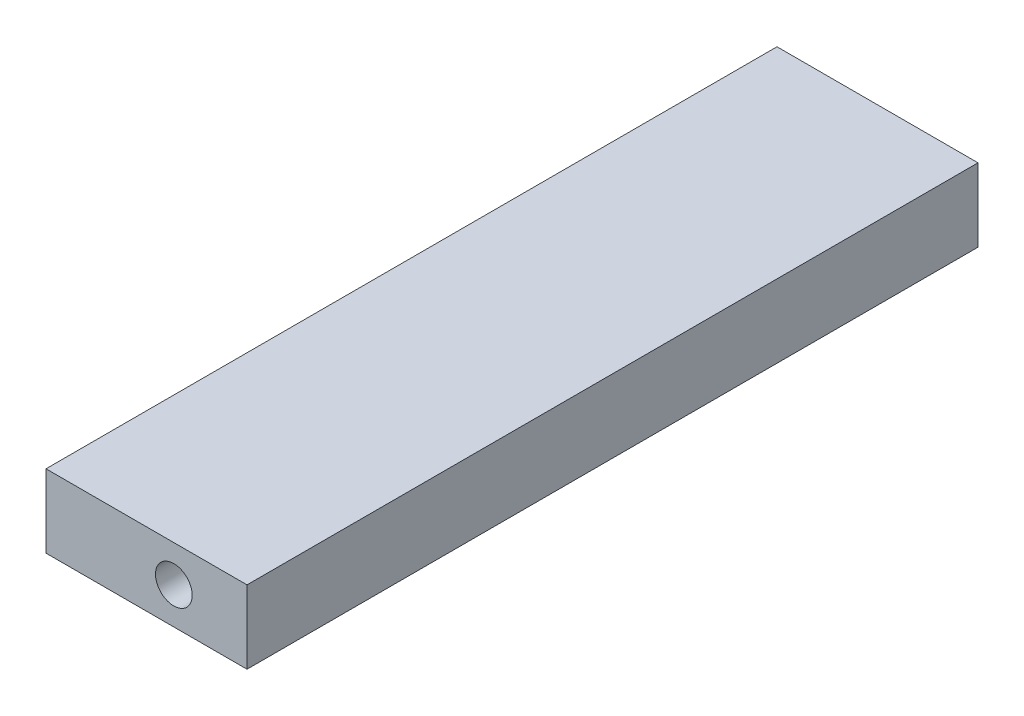
from build123d import *

# Parameters (mm, degrees)
SKETCH1_W               = 27.94
SKETCH1_H               = 10.16
BOSS_EXTRUDE1_DEPTH     = 101.6
SKETCH3_R               = 2.5527
CUT_EXTRUDE2_DEPTH      = 96.148345755
CUT_EXTRUDE3_REACH      = 107.494
CUT_EXTRUDE3_END_RADIUS = 2.5527
SKETCH4_R               = 2.5527


with BuildPart() as part:
    # Sketch1 → Boss-Extrude1 (new body)
    with BuildSketch(Plane.XY):
        Rectangle(SKETCH1_W, SKETCH1_H)
    extrude(amount=BOSS_EXTRUDE1_DEPTH)

    # Sketch3 → Cut-Extrude2 (cut, through all)
    with BuildSketch(Plane(origin=(0, 0, 7.62), x_dir=(-1, 0, 0), z_dir=(0, 0, -1))):
        with Locations((-3.7973, 0)):
            Circle(SKETCH3_R)
    extrude(amount=-CUT_EXTRUDE2_DEPTH, mode=Mode.SUBTRACT)

    # Cut-Extrude3: up to this cylinder (the profile starts outside it)
    cut_extrude3_end = Plane(origin=(3.7973, 0, 49.5554), z_dir=(0, 0, -1)) * Cylinder(CUT_EXTRUDE3_END_RADIUS, 287.1334, mode=Mode.PRIVATE)
    # Sketch4 → Cut-Extrude3 (cut, up to the surface)
    with BuildSketch(Plane.ZY.offset(13.97), mode=Mode.PRIVATE) as cut_extrude3_sk1:
        with Locations((16.5354, 0)):
            Circle(SKETCH4_R)
    cut_extrude3_tool1 = extrude(cut_extrude3_sk1.sketch, amount=-CUT_EXTRUDE3_REACH, mode=Mode.PRIVATE) - cut_extrude3_end
    add(cut_extrude3_tool1.solids().sort_by_distance((-13.97, 0, 16.5354))[0], mode=Mode.SUBTRACT)
    # Sketch4 → Cut-Extrude3 (cut, up to the surface)
    with BuildSketch(Plane.ZY.offset(13.97), mode=Mode.PRIVATE) as cut_extrude3_sk2:
        with Locations((33.0454, 0)):
            Circle(SKETCH4_R)
    cut_extrude3_tool2 = extrude(cut_extrude3_sk2.sketch, amount=-CUT_EXTRUDE3_REACH, mode=Mode.PRIVATE) - cut_extrude3_end
    add(cut_extrude3_tool2.solids().sort_by_distance((-13.97, 0, 33.0454))[0], mode=Mode.SUBTRACT)
    # Sketch4 → Cut-Extrude3 (cut, up to the surface)
    with BuildSketch(Plane.ZY.offset(13.97), mode=Mode.PRIVATE) as cut_extrude3_sk3:
        with Locations((49.5554, 0)):
            Circle(SKETCH4_R)
    cut_extrude3_tool3 = extrude(cut_extrude3_sk3.sketch, amount=-CUT_EXTRUDE3_REACH, mode=Mode.PRIVATE) - cut_extrude3_end
    add(cut_extrude3_tool3.solids().sort_by_distance((-13.97, 0, 49.5554))[0], mode=Mode.SUBTRACT)
    # Sketch4 → Cut-Extrude3 (cut, up to the surface)
    with BuildSketch(Plane.ZY.offset(13.97), mode=Mode.PRIVATE) as cut_extrude3_sk4:
        with Locations((66.0654, 0)):
            Circle(SKETCH4_R)
    cut_extrude3_tool4 = extrude(cut_extrude3_sk4.sketch, amount=-CUT_EXTRUDE3_REACH, mode=Mode.PRIVATE) - cut_extrude3_end
    add(cut_extrude3_tool4.solids().sort_by_distance((-13.97, 0, 66.0654))[0], mode=Mode.SUBTRACT)
    # Sketch4 → Cut-Extrude3 (cut, up to the surface)
    with BuildSketch(Plane.ZY.offset(13.97), mode=Mode.PRIVATE) as cut_extrude3_sk5:
        with Locations((82.5754, 0)):
            Circle(SKETCH4_R)
    cut_extrude3_tool5 = extrude(cut_extrude3_sk5.sketch, amount=-CUT_EXTRUDE3_REACH, mode=Mode.PRIVATE) - cut_extrude3_end
    add(cut_extrude3_tool5.solids().sort_by_distance((-13.97, 0, 82.5754))[0], mode=Mode.SUBTRACT)


solid = part.part
